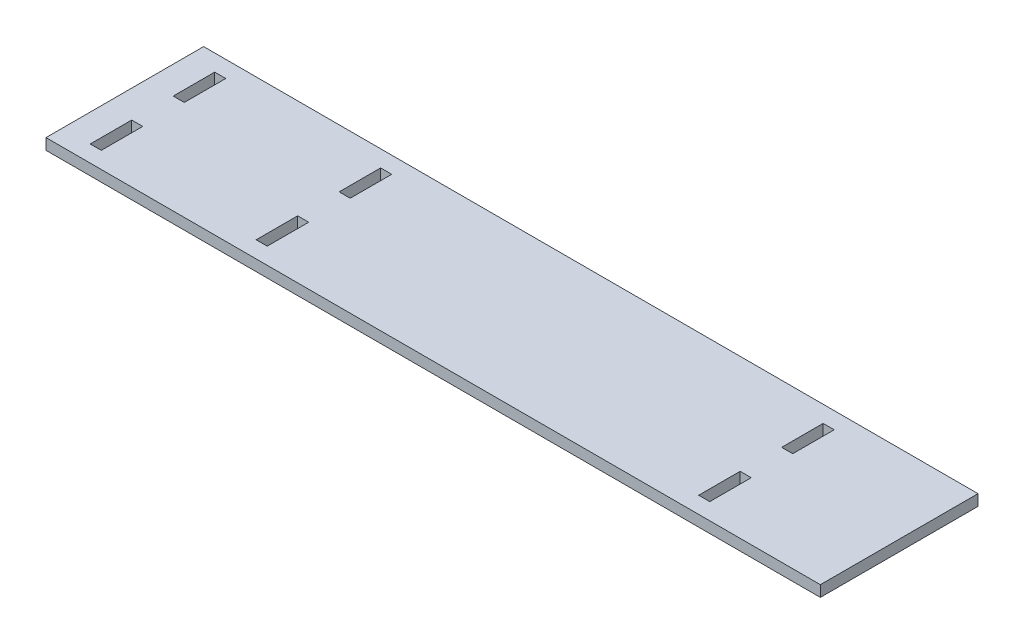
from build123d import *

# Parameters (mm, degrees)
SKETCH1_W           = 280
SKETCH1_H           = 65
BOSS_EXTRUDE1_DEPTH = 4
SKETCH2_W           = 4
SKETCH2_H           = 15
CUT_EXTRUDE1_DEPTH  = 4
SKETCH3_W           = 280
SKETCH3_H           = 4
CUT_EXTRUDE2_DEPTH  = 4


with BuildPart() as part:
    # Sketch1 → Boss-Extrude1 (new body)
    with BuildSketch(Plane(origin=(0, 0, 0), x_dir=(1, 0, 0), z_dir=(0, 1, 0))):
        with Locations((140, 32.5)):
            Rectangle(SKETCH1_W, SKETCH1_H)
    extrude(amount=BOSS_EXTRUDE1_DEPTH)

    # Sketch2 → Cut-Extrude1 (cut)
    with BuildSketch(Plane(origin=(0, 4, 0), x_dir=(1, 0, 0), z_dir=(0, 1, 0))):
        with Locations((12, 47.5)):
            Rectangle(SKETCH2_W, SKETCH2_H)
        with Locations((12, 17.5)):
            Rectangle(SKETCH2_W, SKETCH2_H)
        with Locations((72, 17.5)):
            Rectangle(SKETCH2_W, SKETCH2_H)
        with Locations((72, 47.5)):
            Rectangle(SKETCH2_W, SKETCH2_H)
        with Locations((232, 47.5)):
            Rectangle(SKETCH2_W, SKETCH2_H)
        with Locations((232, 17.5)):
            Rectangle(SKETCH2_W, SKETCH2_H)
    extrude(amount=-CUT_EXTRUDE1_DEPTH, mode=Mode.SUBTRACT)

    # Sketch3 → Cut-Extrude2 (cut)
    with BuildSketch(Plane(origin=(0, 4, 0), x_dir=(1, 0, 0), z_dir=(0, 1, 0))):
        with Locations((140, 63)):
            Rectangle(SKETCH3_W, SKETCH3_H)
        with Locations((140, 2)):
            Rectangle(SKETCH3_W, SKETCH3_H)
    extrude(amount=-CUT_EXTRUDE2_DEPTH, mode=Mode.SUBTRACT)


solid = part.part
